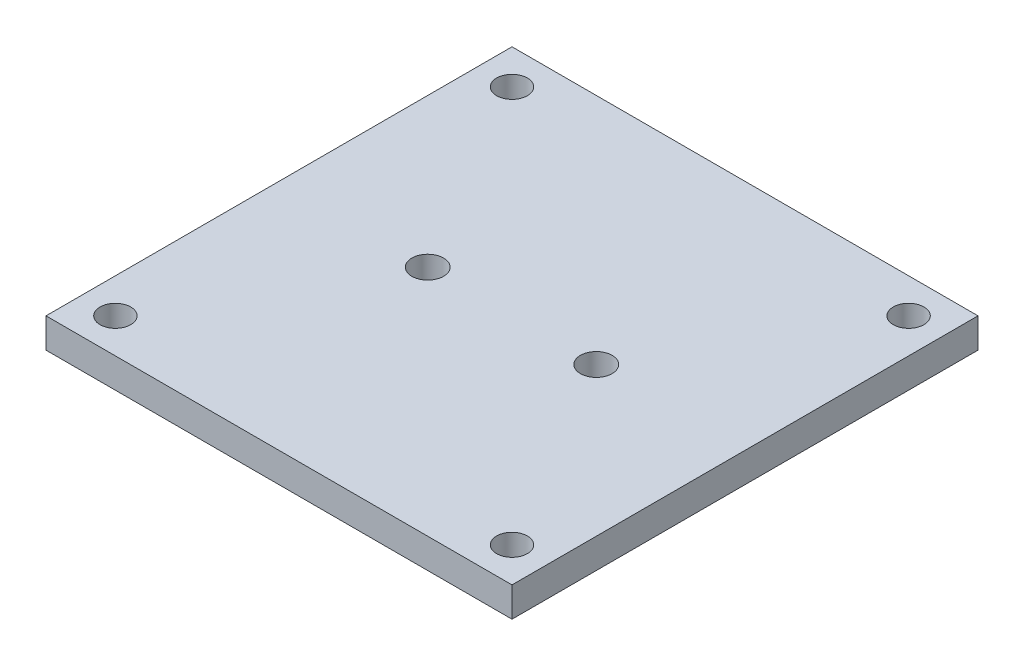
from build123d import *

# Parameters (mm, degrees)
SKETCH_1_W          = 47
SKETCH_1_H          = 47
EXTRUDE_1_DEPTH     = 3
SKETCH_3_R          = 1.55
CUT_EXTRUDE_2_DEPTH = 3
SKETCH_4_R          = 1.6
CUT_EXTRUDE_3_DEPTH = 3


with BuildPart() as part:
    # 草图1 → 凸台-拉伸1 (new body)
    with BuildSketch(Plane(origin=(0, 0, 0), x_dir=(1, 0, 0), z_dir=(0, 1, 0))):
        Rectangle(SKETCH_1_W, SKETCH_1_H)
    extrude(amount=EXTRUDE_1_DEPTH)

    # 草图3 → 切除-拉伸2 (cut)
    with BuildSketch(Plane.XZ):
        with Locations(Location((20, 20, 0), (0, 0, 270))):
            Circle(SKETCH_3_R)
        with Locations(Location((-20, 20, 0), (0, 0, 90))):
            Circle(SKETCH_3_R)
        with Locations(Location((20, -20, 0), (0, 0, 90))):
            Circle(SKETCH_3_R)
        with Locations(Location((-20, -20, 0), (0, 0, 270))):
            Circle(SKETCH_3_R)
    extrude(amount=-CUT_EXTRUDE_2_DEPTH, mode=Mode.SUBTRACT)

    # 草图4 → 切除-拉伸3 (cut)
    with BuildSketch(Plane(origin=(0, 3, 0), x_dir=(1, 0, 0), z_dir=(0, 1, 0))):
        with Locations(Location((-8.5, 0, 0), (0, 0, 270))):
            Circle(SKETCH_4_R)
        with Locations(Location((8.5, 0, 0), (0, 0, 90))):
            Circle(SKETCH_4_R)
    extrude(amount=-CUT_EXTRUDE_3_DEPTH, mode=Mode.SUBTRACT)


solid = part.part
